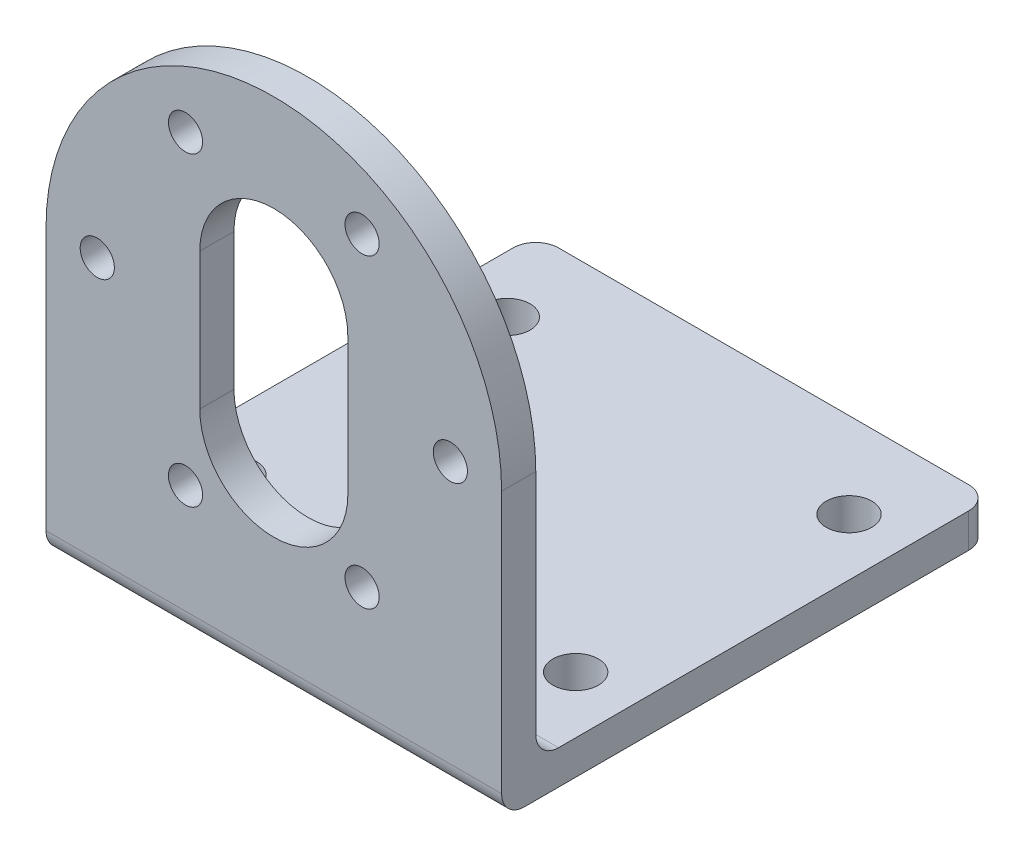
from build123d import *

# Parameters (mm, degrees)
SKETCH_1_R      = 1.5
EXTRUDE_1_DEPTH = 3
SKETCH_2_R      = 2
EXTRUDE_2_DEPTH = 3
FILLET_1_R      = 2


with BuildPart() as part:
    # 草图1 → 凸台-拉伸1 (new body)
    with BuildSketch(Plane.XY):
        with BuildLine():
            Line((-20, 0), (-20, -25))
            Line((-20, -25), (20, -25))
            Line((20, -25), (20, 0))
            ThreePointArc((20, 0), (0, 20), (-20, 0))
        make_face()
        with Locations((7.75, 13.423393759)):
            Circle(SKETCH_1_R, mode=Mode.SUBTRACT)
        with Locations((15.5, 0)):
            Circle(SKETCH_1_R, mode=Mode.SUBTRACT)
        with Locations((7.75, -13.423393759)):
            Circle(SKETCH_1_R, mode=Mode.SUBTRACT)
        with Locations((-7.75, -13.423393759)):
            Circle(SKETCH_1_R, mode=Mode.SUBTRACT)
        with Locations((-15.5, 0)):
            Circle(SKETCH_1_R, mode=Mode.SUBTRACT)
        with Locations((-7.75, 13.423393759)):
            Circle(SKETCH_1_R, mode=Mode.SUBTRACT)
        with BuildLine():
            Line((6.5, 5), (6.5, -7))
            ThreePointArc((6.5, -7), (0, -13.5), (-6.5, -7))
            Line((-6.5, -7), (-6.5, 5))
            ThreePointArc((-6.5, 5), (0, 11.5), (6.5, 5))
        make_face(mode=Mode.SUBTRACT)
    extrude(amount=EXTRUDE_1_DEPTH)

    # 草图2 → 凸台-拉伸2 (add)
    with BuildSketch(Plane.XZ.offset(25)):
        with BuildLine():
            Line((20, 0), (-20, 0))
            Line((-20, 0), (-20, -38))
            ThreePointArc((-20, -38), (-19.414213562, -39.414213562), (-18, -40))
            Line((-18, -40), (18, -40))
            ThreePointArc((18, -40), (19.414213562, -39.414213562), (20, -38))
            Line((20, -38), (20, 0))
        make_face()
        with Locations(Location((-15, -32.5, 0), (0, 0, 270))):
            Circle(SKETCH_2_R, mode=Mode.SUBTRACT)
        with Locations(Location((-15, -8.5, 0), (0, 0, 90))):
            Circle(SKETCH_2_R, mode=Mode.SUBTRACT)
        with Locations(Location((15, -32.5, 0), (0, 0, 90))):
            Circle(SKETCH_2_R, mode=Mode.SUBTRACT)
        with Locations(Location((15, -8.5, 0), (0, 0, 270))):
            Circle(SKETCH_2_R, mode=Mode.SUBTRACT)
    extrude(amount=-EXTRUDE_2_DEPTH)

    # 圆角1
    fillet_1_edges = [part.edges().sort_by_distance(p)[0] for p in [
        (0, -25, 3),
        (0, -22, 0),
    ]]
    fillet(fillet_1_edges, radius=FILLET_1_R)


solid = part.part
